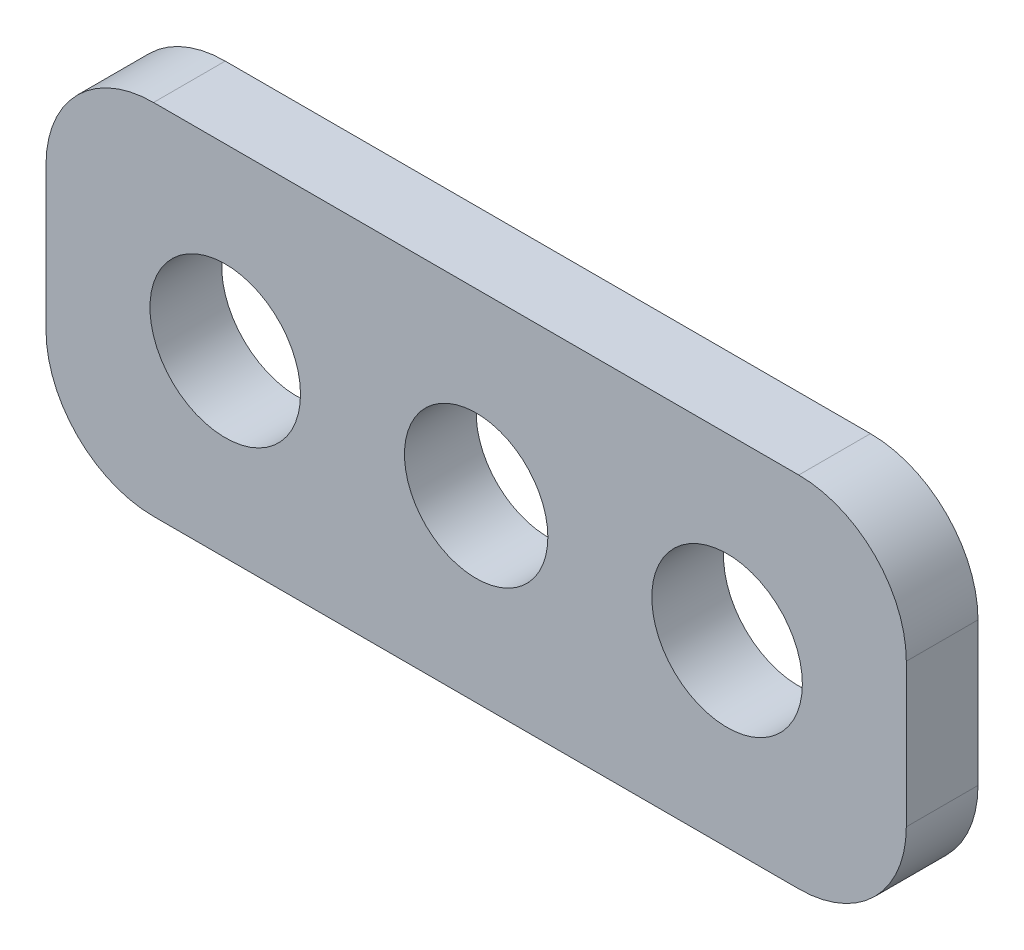
from build123d import *

# Parameters (mm, degrees)
SKETCH1_R           = 1.05
SKETCH1_R_2         = 1
BOSS_EXTRUDE1_DEPTH = 1


with BuildPart() as part:
    # Sketch1 → Boss-Extrude1 (new body)
    with BuildSketch(Plane.XY):
        with BuildLine():
            Line((-3.05, 1.4), (5.95, 1.4))
            ThreePointArc((5.95, 1.4), (7.010660172, 1.839339828), (7.45, 2.9))
            Line((7.45, 2.9), (7.45, 4.9))
            ThreePointArc((7.45, 4.9), (7.010660172, 5.960660172), (5.95, 6.4))
            Line((5.95, 6.4), (-3.05, 6.4))
            ThreePointArc((-3.05, 6.4), (-4.110660172, 5.960660172), (-4.55, 4.9))
            Line((-4.55, 4.9), (-4.55, 2.9))
            ThreePointArc((-4.55, 2.9), (-4.110660172, 1.839339828), (-3.05, 1.4))
        make_face()
        with Locations((-2.05, 3.9)):
            Circle(SKETCH1_R, mode=Mode.SUBTRACT)
        with Locations((4.95, 3.9)):
            Circle(SKETCH1_R, mode=Mode.SUBTRACT)
        with Locations((1.45, 3.9)):
            Circle(SKETCH1_R_2, mode=Mode.SUBTRACT)
    extrude(amount=BOSS_EXTRUDE1_DEPTH)


solid = part.part
